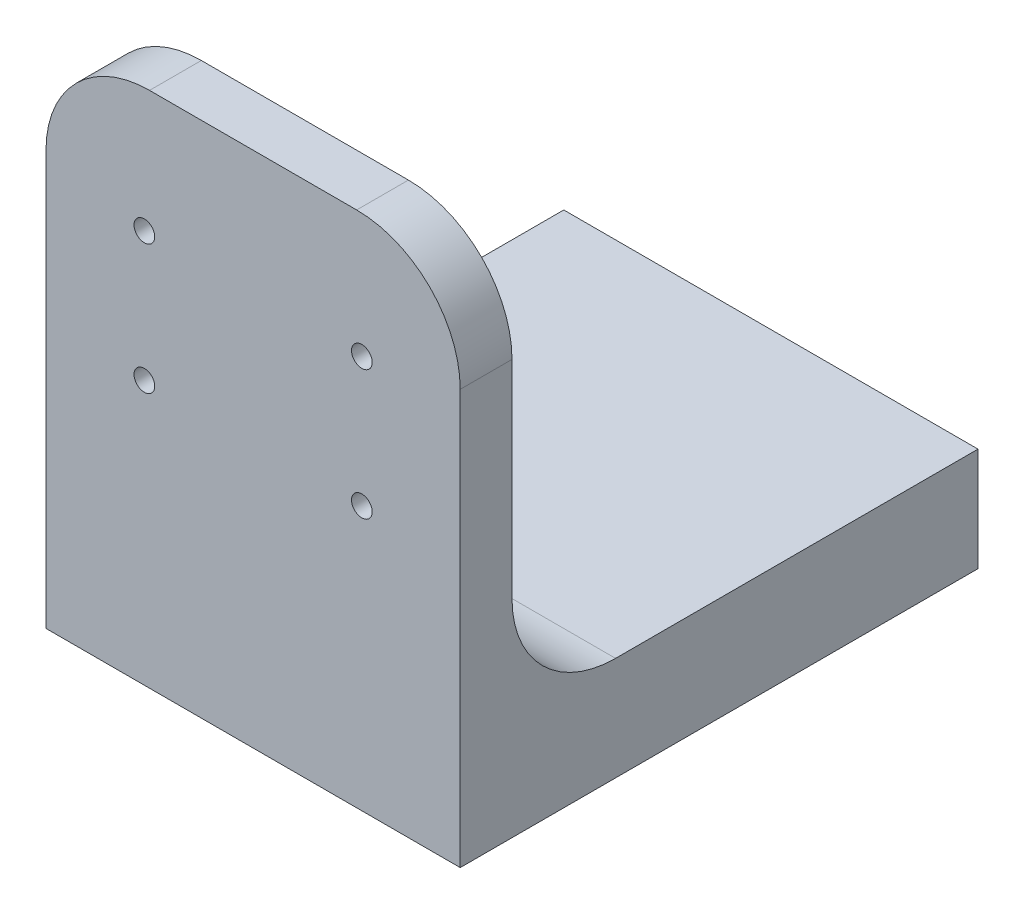
from build123d import *

# Parameters (mm, degrees)
SKETCH1_W             = 40
SKETCH1_H             = 50
BOSS_EXTRUDE1_DEPTH   = 10
SKETCH2_W             = 40
SKETCH2_H             = 5
BOSS_EXTRUDE2_DEPTH   = 40
F_2_0MM_DOWEL_HOLE1_D = 2
FILLET1_R             = 10


with BuildPart() as part:
    # Sketch1 → Boss-Extrude1 (new body)
    with BuildSketch(Plane(origin=(0, 0, 0), x_dir=(1, 0, 0), z_dir=(0, 1, 0))):
        Rectangle(SKETCH1_W, SKETCH1_H)
    extrude(amount=BOSS_EXTRUDE1_DEPTH)

    # Sketch2 → Boss-Extrude2 (add)
    with BuildSketch(Plane(origin=(0, 10, 0), x_dir=(1, 0, 0), z_dir=(0, 1, 0))):
        with Locations((0, -22.5)):
            Rectangle(SKETCH2_W, SKETCH2_H)
    extrude(amount=BOSS_EXTRUDE2_DEPTH)

    # Ø2.0mm Dowel Hole1 (through all)
    with Locations(Plane.XY.offset(25)):
        with Locations((-10.5, 38), (10.5, 38), (-10.5, 25.5), (10.5, 25.5)):
            Hole(F_2_0MM_DOWEL_HOLE1_D / 2)

    # Fillet1
    fillet1_edges = [part.edges().sort_by_distance(p)[0] for p in [
        (0, 10, 20),
        (-20, 50, 22.5),
        (20, 50, 22.5),
    ]]
    fillet(fillet1_edges, radius=FILLET1_R)


solid = part.part
